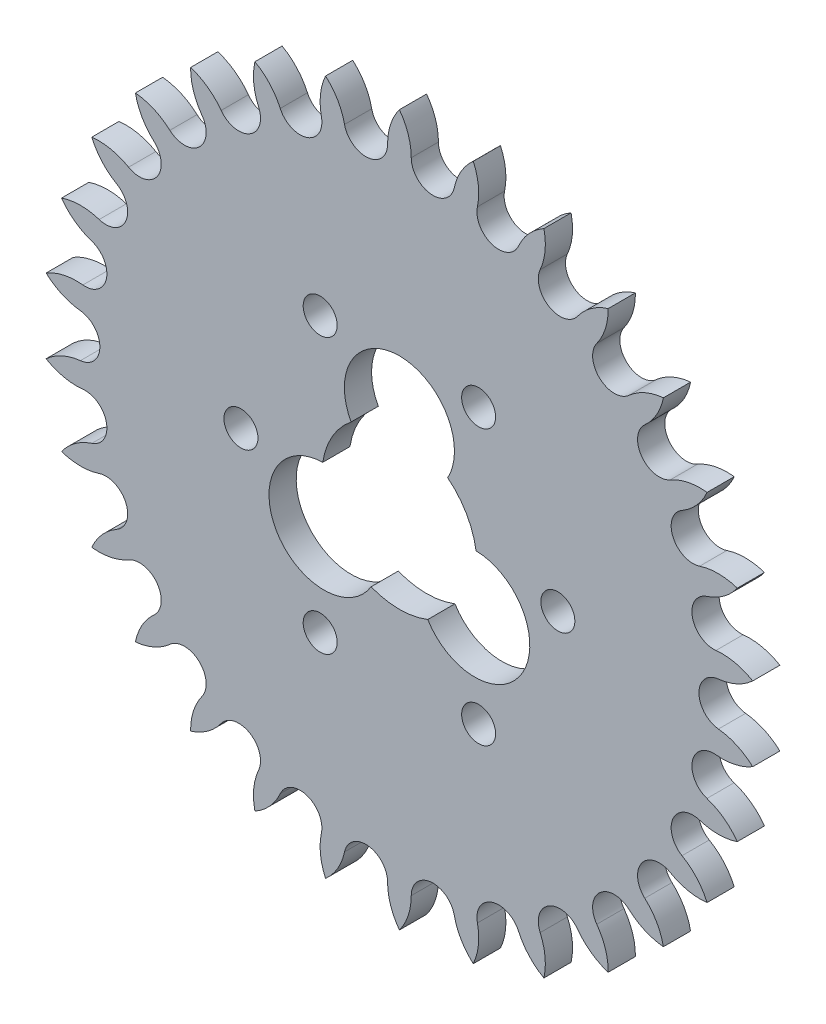
from build123d import *

# Parameters (mm, degrees)
BOSS_EXTRUDE1_DEPTH = 6.35
SKETCH2_R           = 3.96875
CUT_EXTRUDE1_DEPTH  = 118.165311767


with BuildPart() as part:
    # Sketch1 → Boss-Extrude1 (new body)
    with BuildSketch(Plane.XY):
        with BuildLine():
            ThreePointArc((-2.76225, 74.614024644), (-2.053719894, 79.00655424), (0, 82.953523426))
            ThreePointArc((0, 82.953523426), (2.053719894, 79.00655424), (2.76225, 74.614024644))
            ThreePointArc((2.76225, 74.614024644), (7.311245407, 69.561853415), (12.811239812, 73.557833254))
            ThreePointArc((12.811239812, 73.557833254), (14.417545091, 77.707063847), (17.247007315, 81.140789912))
            ThreePointArc((17.247007315, 81.140789912), (18.435227465, 76.853079096), (18.215016233, 72.409225119))
            ThreePointArc((18.215016233, 72.409225119), (21.614199713, 66.521666626), (27.82481697, 69.286811582))
            ThreePointArc((27.82481697, 69.286811582), (30.258694172, 73.011401885), (33.74023765, 75.781814521))
            ThreePointArc((33.74023765, 75.781814521), (34.011027133, 71.340755614), (32.87169885, 67.039794998))
            ThreePointArc((32.87169885, 67.039794998), (34.972509775, 60.574163799), (41.622316107, 61.987623769))
            ThreePointArc((41.622316107, 61.987623769), (44.777393121, 65.124791313), (48.758857695, 67.110810195))
            ThreePointArc((48.758857695, 67.110810195), (48.100381712, 62.710498781), (46.091730493, 58.740404142))
            ThreePointArc((46.091730493, 58.740404142), (46.802353344, 51.979279347), (53.600720305, 51.979279347))
            ThreePointArc((53.600720305, 51.979279347), (57.339105124, 54.391914857), (61.646481689, 55.50674143))
            ThreePointArc((61.646481689, 55.50674143), (60.0875188, 51.339492232), (57.29733234, 47.873775759))
            ThreePointArc((57.29733234, 47.873775759), (56.586709488, 41.112650963), (63.23651582, 39.699190994))
            ThreePointArc((63.23651582, 39.699190994), (67.39482309, 41.28185072), (71.83985862, 41.476761713))
            ThreePointArc((71.83985862, 41.476761713), (69.448542984, 37.724703519), (65.99876582, 34.91483365))
            ThreePointArc((65.99876582, 34.91483365), (63.897954895, 28.449202452), (70.108572152, 25.684057496))
            ThreePointArc((70.108572152, 25.684057496), (74.505063891, 26.367571615), (78.893489004, 25.634048482))
            ThreePointArc((78.893489004, 25.634048482), (75.774332589, 22.461164239), (71.815736537, 20.429945772))
            ThreePointArc((71.815736537, 20.429945772), (68.416553057, 14.542387279), (73.916547462, 10.54640744))
            ThreePointArc((73.916547462, 10.54640744), (78.359075884, 10.300903104), (82.499095345, 8.671004326))
            ThreePointArc((82.499095345, 8.671004326), (78.788420253, 6.215964301), (74.494014958, 5.052171229))
            ThreePointArc((74.494014958, 5.052171229), (69.945019551, 0), (74.494014958, -5.052171229))
            ThreePointArc((74.494014958, -5.052171229), (78.788420253, -6.215964301), (82.499095345, -8.671004326))
            ThreePointArc((82.499095345, -8.671004326), (78.359075884, -10.300903104), (73.916547462, -10.54640744))
            ThreePointArc((73.916547462, -10.54640744), (68.416553057, -14.542387279), (71.815736537, -20.429945772))
            ThreePointArc((71.815736537, -20.429945772), (75.774332589, -22.461164239), (78.893489004, -25.634048482))
            ThreePointArc((78.893489004, -25.634048482), (74.505063891, -26.367571615), (70.108572152, -25.684057496))
            ThreePointArc((70.108572152, -25.684057496), (63.897954895, -28.449202452), (65.99876582, -34.91483365))
            ThreePointArc((65.99876582, -34.91483365), (69.448542984, -37.724703519), (71.83985862, -41.476761713))
            ThreePointArc((71.83985862, -41.476761713), (67.39482309, -41.28185072), (63.23651582, -39.699190994))
            ThreePointArc((63.23651582, -39.699190994), (56.586709488, -41.112650963), (57.29733234, -47.873775759))
            ThreePointArc((57.29733234, -47.873775759), (60.0875188, -51.339492232), (61.646481689, -55.50674143))
            ThreePointArc((61.646481689, -55.50674143), (57.339105124, -54.391914857), (53.600720305, -51.979279347))
            ThreePointArc((53.600720305, -51.979279347), (46.802353344, -51.979279347), (46.091730493, -58.740404142))
            ThreePointArc((46.091730493, -58.740404142), (48.100381712, -62.710498781), (48.758857695, -67.110810195))
            ThreePointArc((48.758857695, -67.110810195), (44.777393121, -65.124791313), (41.622316107, -61.987623769))
            ThreePointArc((41.622316107, -61.987623769), (34.972509775, -60.574163799), (32.87169885, -67.039794998))
            ThreePointArc((32.87169885, -67.039794998), (34.011027133, -71.340755614), (33.74023765, -75.781814521))
            ThreePointArc((33.74023765, -75.781814521), (30.258694172, -73.011401885), (27.82481697, -69.286811582))
            ThreePointArc((27.82481697, -69.286811582), (21.614199713, -66.521666626), (18.215016233, -72.409225119))
            ThreePointArc((18.215016233, -72.409225119), (18.435227465, -76.853079096), (17.247007315, -81.140789912))
            ThreePointArc((17.247007315, -81.140789912), (14.417545091, -77.707063847), (12.811239812, -73.557833254))
            ThreePointArc((12.811239812, -73.557833254), (7.311245407, -69.561853415), (2.76225, -74.614024644))
            ThreePointArc((2.76225, -74.614024644), (2.053719894, -79.00655424), (0, -82.953523426))
            ThreePointArc((0, -82.953523426), (-2.053719894, -79.00655424), (-2.76225, -74.614024644))
            ThreePointArc((-2.76225, -74.614024644), (-7.311245407, -69.561853415), (-12.811239812, -73.557833254))
            ThreePointArc((-12.811239812, -73.557833254), (-14.417545091, -77.707063847), (-17.247007315, -81.140789912))
            ThreePointArc((-17.247007315, -81.140789912), (-18.435227465, -76.853079096), (-18.215016233, -72.409225119))
            ThreePointArc((-18.215016233, -72.409225119), (-21.614199713, -66.521666626), (-27.82481697, -69.286811582))
            ThreePointArc((-27.82481697, -69.286811582), (-30.258694172, -73.011401885), (-33.74023765, -75.781814521))
            ThreePointArc((-33.74023765, -75.781814521), (-34.011027133, -71.340755614), (-32.87169885, -67.039794998))
            ThreePointArc((-32.87169885, -67.039794998), (-34.972509775, -60.574163799), (-41.622316107, -61.987623769))
            ThreePointArc((-41.622316107, -61.987623769), (-44.777393121, -65.124791313), (-48.758857695, -67.110810195))
            ThreePointArc((-48.758857695, -67.110810195), (-48.100381712, -62.710498781), (-46.091730493, -58.740404142))
            ThreePointArc((-46.091730493, -58.740404142), (-46.802353344, -51.979279347), (-53.600720305, -51.979279347))
            ThreePointArc((-53.600720305, -51.979279347), (-57.339105124, -54.391914857), (-61.646481689, -55.50674143))
            ThreePointArc((-61.646481689, -55.50674143), (-60.0875188, -51.339492232), (-57.29733234, -47.873775759))
            ThreePointArc((-57.29733234, -47.873775759), (-56.586709488, -41.112650963), (-63.23651582, -39.699190994))
            ThreePointArc((-63.23651582, -39.699190994), (-67.39482309, -41.28185072), (-71.83985862, -41.476761713))
            ThreePointArc((-71.83985862, -41.476761713), (-69.448542984, -37.724703519), (-65.99876582, -34.91483365))
            ThreePointArc((-65.99876582, -34.91483365), (-63.897954895, -28.449202452), (-70.108572152, -25.684057496))
            ThreePointArc((-70.108572152, -25.684057496), (-74.505063891, -26.367571615), (-78.893489004, -25.634048482))
            ThreePointArc((-78.893489004, -25.634048482), (-75.774332589, -22.461164239), (-71.815736537, -20.429945772))
            ThreePointArc((-71.815736537, -20.429945772), (-68.416553057, -14.542387279), (-73.916547462, -10.54640744))
            ThreePointArc((-73.916547462, -10.54640744), (-78.359075884, -10.300903104), (-82.499095345, -8.671004326))
            ThreePointArc((-82.499095345, -8.671004326), (-78.788420253, -6.215964301), (-74.494014958, -5.052171229))
            ThreePointArc((-74.494014958, -5.052171229), (-69.945019551, 0), (-74.494014958, 5.052171229))
            ThreePointArc((-74.494014958, 5.052171229), (-78.788420253, 6.215964301), (-82.499095345, 8.671004326))
            ThreePointArc((-82.499095345, 8.671004326), (-78.359075884, 10.300903104), (-73.916547462, 10.54640744))
            ThreePointArc((-73.916547462, 10.54640744), (-68.416553057, 14.542387279), (-71.815736537, 20.429945772))
            ThreePointArc((-71.815736537, 20.429945772), (-75.774332589, 22.461164239), (-78.893489004, 25.634048482))
            ThreePointArc((-78.893489004, 25.634048482), (-74.505063891, 26.367571615), (-70.108572152, 25.684057496))
            ThreePointArc((-70.108572152, 25.684057496), (-63.897954895, 28.449202452), (-65.99876582, 34.91483365))
            ThreePointArc((-65.99876582, 34.91483365), (-69.448542984, 37.724703519), (-71.83985862, 41.476761713))
            ThreePointArc((-71.83985862, 41.476761713), (-67.39482309, 41.28185072), (-63.23651582, 39.699190994))
            ThreePointArc((-63.23651582, 39.699190994), (-56.586709488, 41.112650963), (-57.29733234, 47.873775759))
            ThreePointArc((-57.29733234, 47.873775759), (-60.0875188, 51.339492232), (-61.646481689, 55.50674143))
            ThreePointArc((-61.646481689, 55.50674143), (-57.339105124, 54.391914857), (-53.600720305, 51.979279347))
            ThreePointArc((-53.600720305, 51.979279347), (-46.802353344, 51.979279347), (-46.091730493, 58.740404142))
            ThreePointArc((-46.091730493, 58.740404142), (-48.100381712, 62.710498781), (-48.758857695, 67.110810195))
            ThreePointArc((-48.758857695, 67.110810195), (-44.777393121, 65.124791313), (-41.622316107, 61.987623769))
            ThreePointArc((-41.622316107, 61.987623769), (-34.972509775, 60.574163799), (-32.87169885, 67.039794998))
            ThreePointArc((-32.87169885, 67.039794998), (-34.011027133, 71.340755614), (-33.74023765, 75.781814521))
            ThreePointArc((-33.74023765, 75.781814521), (-30.258694172, 73.011401885), (-27.82481697, 69.286811582))
            ThreePointArc((-27.82481697, 69.286811582), (-21.614199713, 66.521666626), (-18.215016233, 72.409225119))
            ThreePointArc((-18.215016233, 72.409225119), (-18.435227465, 76.853079096), (-17.247007315, 81.140789912))
            ThreePointArc((-17.247007315, 81.140789912), (-14.417545091, 77.707063847), (-12.811239812, 73.557833254))
            ThreePointArc((-12.811239812, 73.557833254), (-7.311245407, 69.561853415), (-2.76225, 74.614024644))
        make_face()
    extrude(amount=BOSS_EXTRUDE1_DEPTH)

    # Sketch2 → Cut-Extrude1 (cut, through all)
    with BuildSketch(Plane.XY.offset(6.35)):
        with Locations((-37, 0)):
            Circle(SKETCH2_R)
        with Locations((-18.5, 32.04293994)):
            Circle(SKETCH2_R)
        with Locations((18.5, 32.04293994)):
            Circle(SKETCH2_R)
        with Locations((37, 0)):
            Circle(SKETCH2_R)
        with Locations((18.5, -32.04293994)):
            Circle(SKETCH2_R)
        with Locations((-18.5, -32.04293994)):
            Circle(SKETCH2_R)
        with BuildLine():
            ThreePointArc((-11.27698735, 14.154471469), (-15.672894745, 9.04875), (-17.896625544, 2.688921789))
            ThreePointArc((-17.896625544, 2.688921789), (-28.728141104, -16.5862), (-6.619638194, -16.843393258))
            ThreePointArc((-6.619638194, -16.843393258), (0, -18.0975), (6.619638194, -16.843393258))
            ThreePointArc((6.619638194, -16.843393258), (28.728141104, -16.5862), (17.896625544, 2.688921789))
            ThreePointArc((17.896625544, 2.688921789), (15.672894745, 9.04875), (11.27698735, 14.154471469))
            ThreePointArc((11.27698735, 14.154471469), (0, 33.1724), (-11.27698735, 14.154471469))
        make_face()
    extrude(amount=-CUT_EXTRUDE1_DEPTH, mode=Mode.SUBTRACT)


solid = part.part
